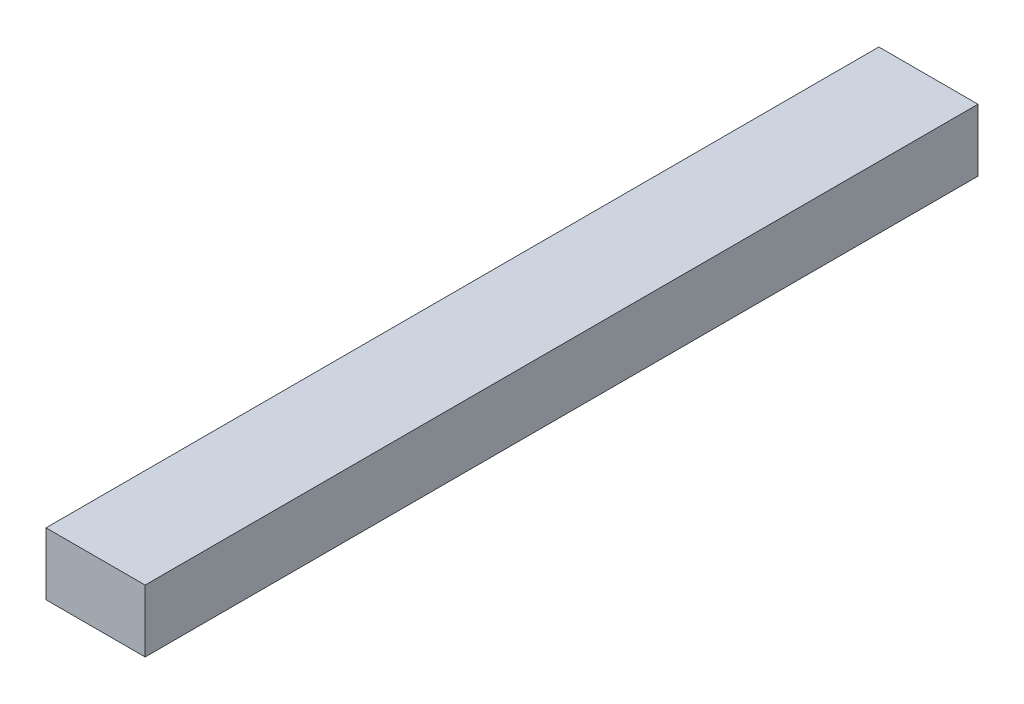
from build123d import *

# Parameters (mm, degrees)
BOSS_EXTRUDE1_DEPTH      = 294
BOSS_EXTRUDE1_DEPTH_BACK = 294
SKETCH1_W                = 70
SKETCH1_H                = 44


with BuildPart() as part:
    # Sketch1 → Boss-Extrude1 (new, two sides: drawn at the far end of the back side and taken through both)
    with BuildSketch(Plane.XY.offset(-BOSS_EXTRUDE1_DEPTH_BACK)):
        Rectangle(SKETCH1_W, SKETCH1_H)
    extrude(amount=BOSS_EXTRUDE1_DEPTH + BOSS_EXTRUDE1_DEPTH_BACK)


solid = part.part
